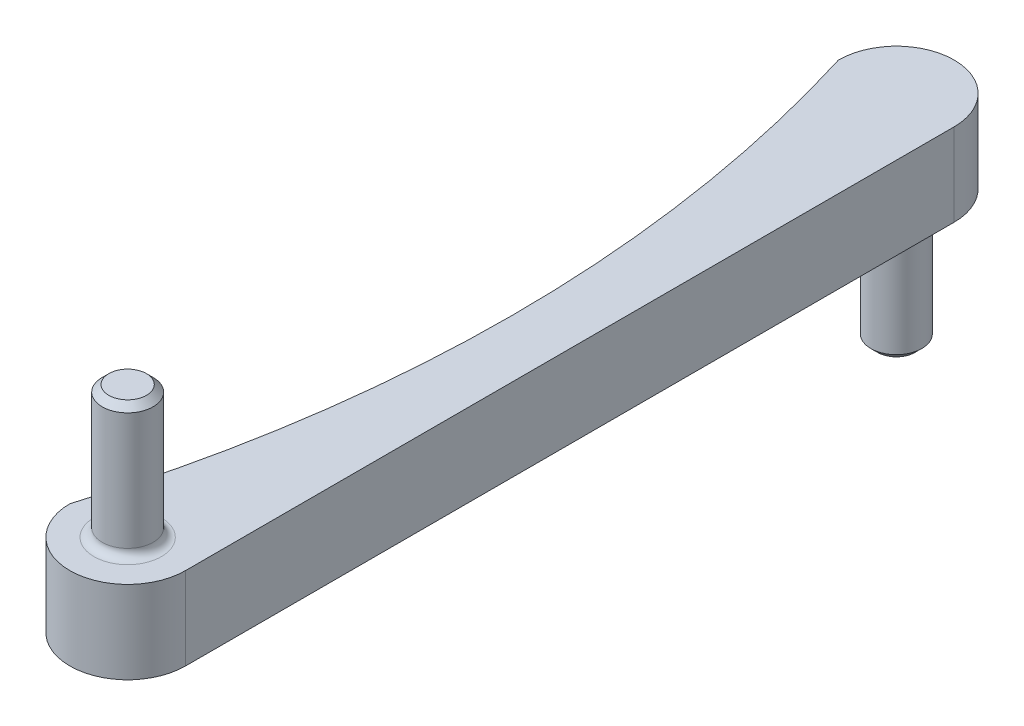
from build123d import *

# Parameters (mm, degrees)
BOSS_EXTRUDE1_DEPTH = 6.35
SKETCH3_R           = 1.9558
BOSS_EXTRUDE3_DEPTH = 10.16
SKETCH4_R           = 1.9558
BOSS_EXTRUDE4_DEPTH = 10.16
CUT_EXTRUDE1_DEPTH  = 66.761600688
FILLET2_R           = 0.635
CHAMFER4_SIZE       = 0.508


with BuildPart() as part:
    # Sketch1 → Boss-Extrude1 (new body)
    with BuildSketch(Plane(origin=(0, 0, 0), x_dir=(1, 0, 0), z_dir=(0, 1, 0))):
        with BuildLine():
            Line((-4.445, 0), (-4.445, 59.055))
            ThreePointArc((-4.445, 59.055), (0, 63.5), (4.445, 59.055))
            Line((4.445, 59.055), (4.445, 0))
            ThreePointArc((4.445, 0), (0, -4.445), (-4.445, 0))
        make_face()
    extrude(amount=BOSS_EXTRUDE1_DEPTH)

    # Sketch3 → Boss-Extrude3 (add)
    with BuildSketch(Plane(origin=(0, 6.35, 0), x_dir=(1, 0, 0), z_dir=(0, 1, 0))):
        with Locations(Location((0, 0, 0), (0, 0, 270))):
            Circle(SKETCH3_R)
    extrude(amount=BOSS_EXTRUDE3_DEPTH)

    # Sketch4 → Boss-Extrude4 (add)
    with BuildSketch(Plane.XZ):
        with Locations(Location((0, -59.055, 0), (0, 0, 90))):
            Circle(SKETCH4_R)
    extrude(amount=BOSS_EXTRUDE4_DEPTH)

    # Sketch5 → Cut-Extrude1 (cut, through all)
    with BuildSketch(Plane(origin=(0, 6.35, 0), x_dir=(1, 0, 0), z_dir=(0, 1, 0))):
        with BuildLine():
            Line((-4.445, 59.055), (-4.445, 0))
            ThreePointArc((-4.445, 0), (0.015635542, 29.5275), (-4.445, 59.055))
        make_face()
    extrude(amount=-CUT_EXTRUDE1_DEPTH, mode=Mode.SUBTRACT)

    # Fillet2
    fillet2_edges = [part.edges().sort_by_distance(p)[0] for p in [
        (0, 6.35, -1.9558),
        (0, 0, -61.0108),
    ]]
    fillet(fillet2_edges, radius=FILLET2_R)

    # Chamfer4
    chamfer4_edges = [part.edges().sort_by_distance(p)[0] for p in [
        (0, 16.51, -1.9558),
        (0, -10.16, -61.0108),
    ]]
    chamfer(chamfer4_edges, length=CHAMFER4_SIZE)


solid = part.part
